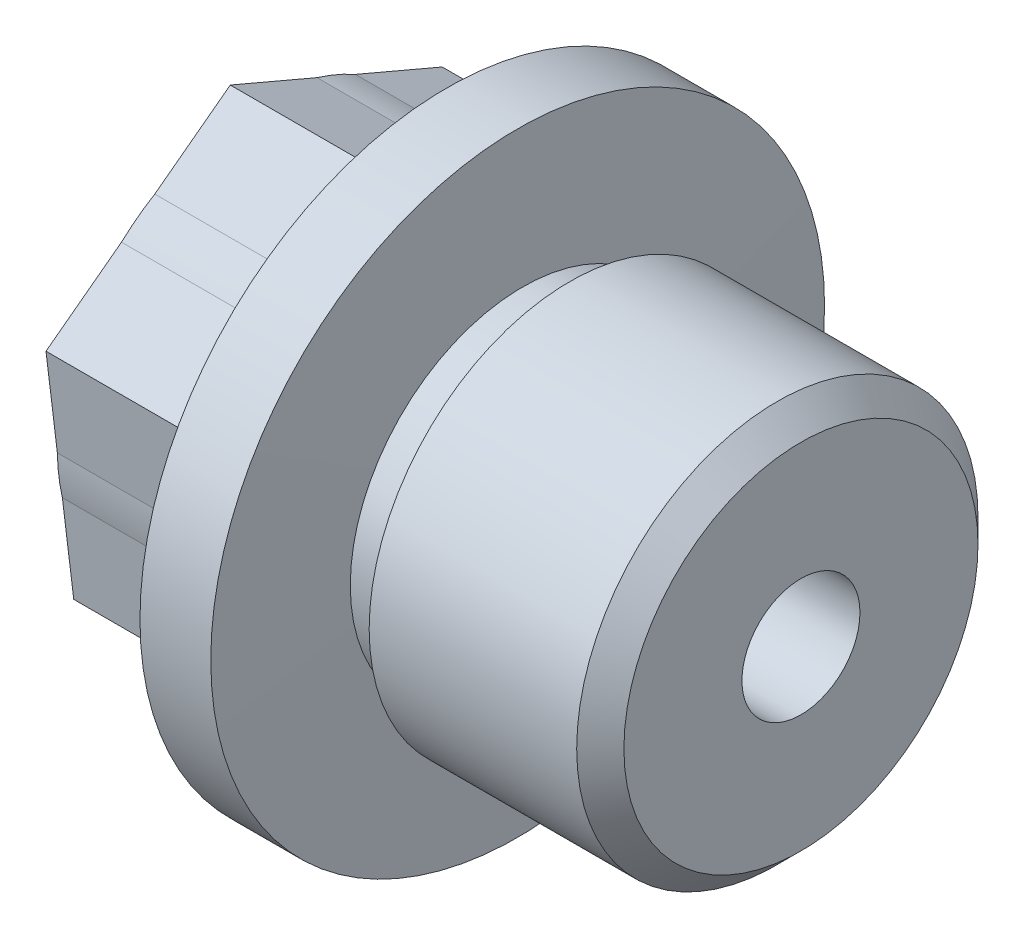
from build123d import *

# Parameters (mm, degrees)
EXTRUDE_START            = -8
SKETCH_2_R               = 8.5
EXTRUDE_1_DEPTH          = 8
CHAMFER_1_SIZE           = 1
SKETCH_3_R               = 2.5
CUT_EXTRUDE_1_DEPTH      = 18
CUT_EXTRUDE_2_DEPTH      = 18
CUT_EXTRUDE_2_DEPTH_BACK = 8.454068
SKETCH_4_R               = 2.5


with BuildPart() as part:
    # Sketch 1 → 旋转1 (revolve)
    with BuildSketch(Plane.XY, mode=Mode.PRIVATE) as revolve_1_sk:
        Polygon((0, 0), (0, 8.5), (8, 8.5), (8, 13), (11, 13), (11.209265355, 7.3), (13.209265355, 7.3), (13.209265355, 8.5), (23, 8.5), (23, 0), align=None)
    revolve(revolve_1_sk.sketch.rotate(Axis((0, 0, 0), (1, 0, 0)), 90), axis=Axis((0, 0, 0), (1, 0, 0)))

    # 草图2 → 凸台-拉伸1 (add)
    # profile 1 of 7: a face of its own
    with BuildSketch(Plane.ZY.offset(EXTRUDE_START)):
        Polygon((-1.174764966, -9.690972033), (7.805245485, -5.86286232), (8.980010451, 3.828109713), (1.174764966, 9.690972033), (-7.805245485, 5.86286232), (-8.980010451, -3.828109713), align=None)
        Circle(SKETCH_2_R, mode=Mode.SUBTRACT)
    # profile 2 of 7: a face of its own
    with BuildSketch(Plane.ZY.offset(EXTRUDE_START)):
        with BuildLine():
            Line((-7.805245485, 5.86286232), (-8.286430908, 1.893426207))
            ThreePointArc((-8.286430908, 1.893426207), (-6.796266629, 5.104974035), (-4.12702026, 7.430861577))
            Line((-4.12702026, 7.430861577), (-7.805245485, 5.86286232))
        make_face()
    # profile 3 of 7: a face of its own
    with BuildSketch(Plane.ZY.offset(EXTRUDE_START)):
        with BuildLine():
            ThreePointArc((-2.503460259, 8.122972777), (1.022903886, 8.43822657), (4.371804767, 7.289535176))
            Line((4.371804767, 7.289535176), (1.174764966, 9.690972033))
            Line((1.174764966, 9.690972033), (-2.503460259, 8.122972777))
        make_face()
    # profile 4 of 7: a face of its own
    with BuildSketch(Plane.ZY.offset(EXTRUDE_START)):
        with BuildLine():
            ThreePointArc((8.5, 0), (8.499706252, -0.070665642), (8.498825028, -0.141326401))
            Line((8.498825028, -0.141326401), (8.980010451, 3.828109713))
            Line((8.980010451, 3.828109713), (5.78297065, 6.22954657))
            ThreePointArc((5.78297065, 6.22954657), (7.79118895, 3.398142837), (8.5, 0))
        make_face()
    # profile 5 of 7: a face of its own
    with BuildSketch(Plane.ZY.offset(EXTRUDE_START)):
        with BuildLine():
            Line((4.12702026, -7.430861577), (7.805245485, -5.86286232))
            Line((7.805245485, -5.86286232), (8.286430908, -1.893426207))
            ThreePointArc((8.286430908, -1.893426207), (6.796266629, -5.104974035), (4.12702026, -7.430861577))
        make_face()
    # profile 6 of 7: a face of its own
    with BuildSketch(Plane.ZY.offset(EXTRUDE_START)):
        with BuildLine():
            Line((-1.174764966, -9.690972033), (2.503460259, -8.122972777))
            ThreePointArc((2.503460259, -8.122972777), (-1.022903886, -8.43822657), (-4.371804767, -7.289535176))
            Line((-4.371804767, -7.289535176), (-1.174764966, -9.690972033))
        make_face()
    # profile 7 of 7: a face of its own
    with BuildSketch(Plane.ZY.offset(EXTRUDE_START)):
        with BuildLine():
            Line((-8.980010451, -3.828109713), (-5.78297065, -6.22954657))
            ThreePointArc((-5.78297065, -6.22954657), (-7.819170515, -3.333252534), (-8.498825028, 0.141326401))
            Line((-8.498825028, 0.141326401), (-8.980010451, -3.828109713))
        make_face()
    extrude(amount=EXTRUDE_1_DEPTH)

    # 倒角1
    chamfer_1_edges = [part.edges().sort_by_distance(p)[0] for p in [
        (23, 0, -8.5),
    ]]
    chamfer(chamfer_1_edges, length=CHAMFER_1_SIZE)

    # 草图3 → 切除-拉伸1 (cut)
    with BuildSketch(Plane(origin=(23, 0, 0), x_dir=(0, 0, -1), z_dir=(1, 0, 0))):
        Circle(SKETCH_3_R)
    extrude(amount=-CUT_EXTRUDE_1_DEPTH, mode=Mode.SUBTRACT)

    # 草图4 → 切除-拉伸2 (cut, two sides: drawn at the far end of the back side and taken through both)
    with BuildSketch(Plane(origin=(0, -6.759540873, -5.077387708), x_dir=(1, 0, 0), z_dir=(0, -0.7995607799259467, -0.6005851806398588)).offset(-CUT_EXTRUDE_2_DEPTH_BACK)):
        with Locations(Location((4, 0, 0), (0, 0, 66.421821522))):
            Circle(SKETCH_4_R)
    extrude(amount=CUT_EXTRUDE_2_DEPTH + CUT_EXTRUDE_2_DEPTH_BACK, mode=Mode.SUBTRACT)


solid = part.part
